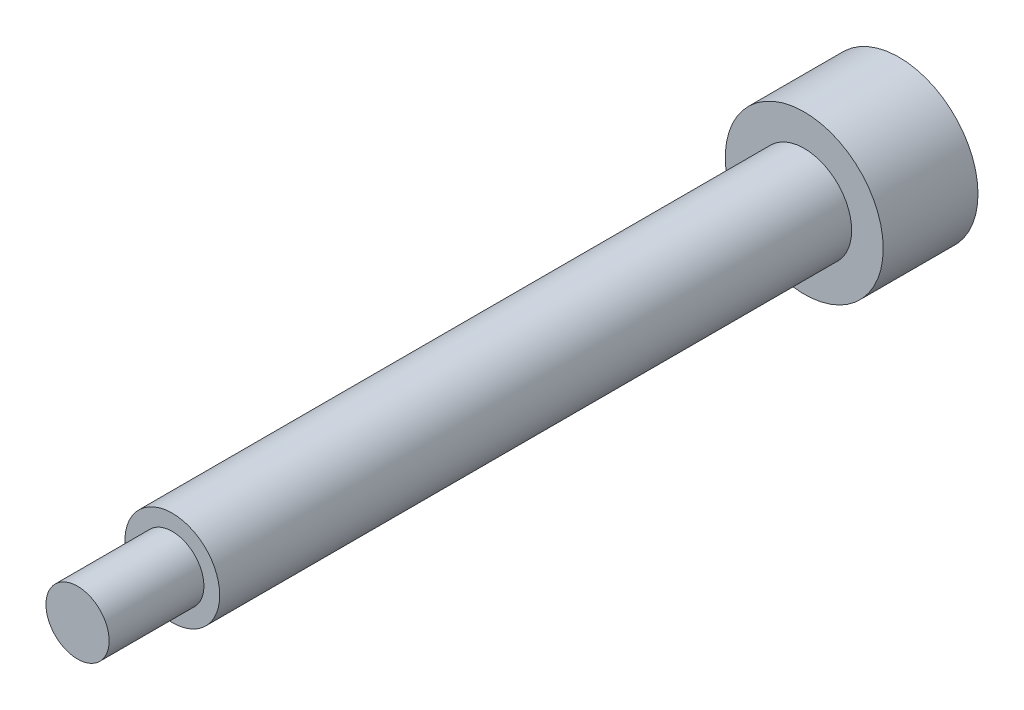
from build123d import *

# Parameters (mm, degrees)
CROQUIS1_R              = 5
SALIENTE_EXTRUIR1_DEPTH = 6
CORTAR_EXTRUIR1_DEPTH   = 5
CROQUIS3_R              = 3
SALIENTE_EXTRUIR2_DEPTH = 40
CROQUIS4_R              = 2
SALIENTE_EXTRUIR3_DEPTH = 6


with BuildPart() as part:
    # Croquis1 → Saliente-Extruir1 (new body)
    with BuildSketch(Plane.XY):
        Circle(CROQUIS1_R)
    extrude(amount=SALIENTE_EXTRUIR1_DEPTH)

    # Croquis2 → Cortar-Extruir1 (cut)
    with BuildSketch(Plane(origin=(0, 0, 0), x_dir=(-1, 0, 0), z_dir=(0, 0, -1))):
        with BuildLine():
            Line((-1.118033989, -1), (0, -1))
            Line((0, -1), (0.606924942, -1))
            Line((0.606924942, -1), (1.118033989, -1))
            ThreePointArc((1.118033989, -1), (0, 1.5), (-1.118033989, -1))
        make_face()
    extrude(amount=-CORTAR_EXTRUIR1_DEPTH, mode=Mode.SUBTRACT)

    # Croquis3 → Saliente-Extruir2 (add)
    with BuildSketch(Plane.XY.offset(6)):
        Circle(CROQUIS3_R)
    extrude(amount=SALIENTE_EXTRUIR2_DEPTH)

    # Croquis4 → Saliente-Extruir3 (add)
    with BuildSketch(Plane.XY.offset(46)):
        Circle(CROQUIS4_R)
    extrude(amount=SALIENTE_EXTRUIR3_DEPTH)


solid = part.part
